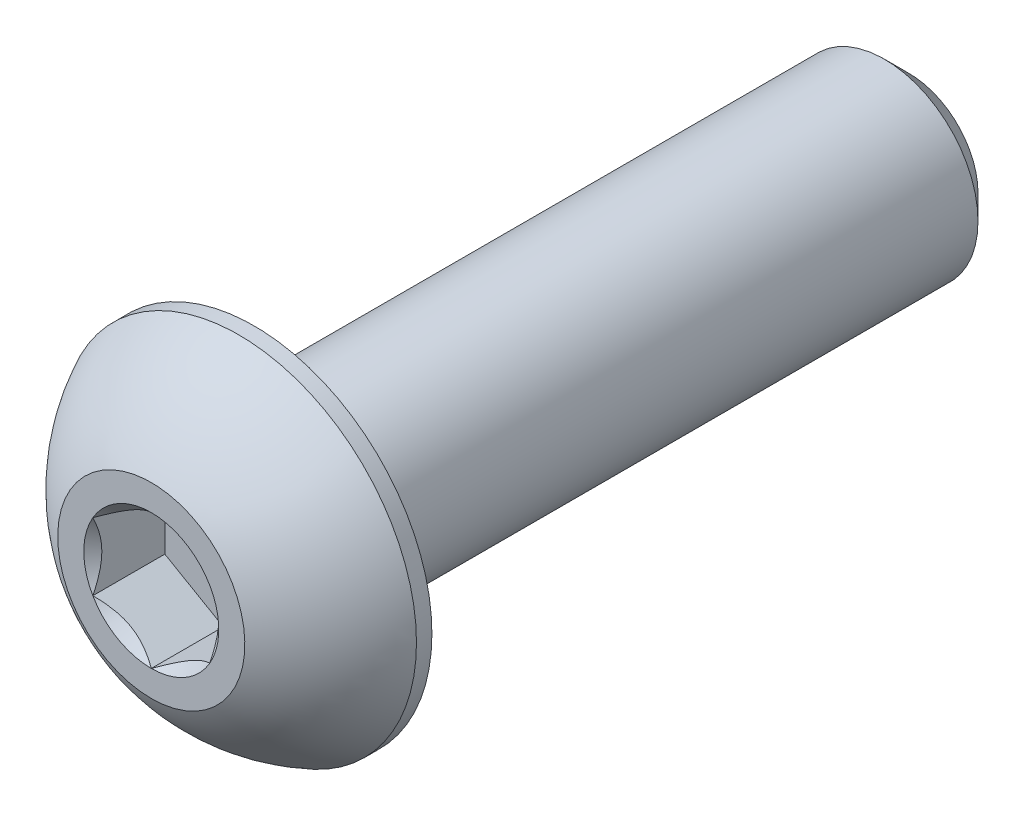
from build123d import *

# Parameters (mm, degrees)
CUT_EXTRUDE2_DEPTH = 1.54


with BuildPart() as part:
    # Sketch10 → Revolve3 (revolve)
    with BuildSketch(Plane(origin=(0, 0, 0), x_dir=(0, 0, -1), z_dir=(1, 0, 0))):
        Polygon((15.675, 2), (16.2, 1.475), (16.2, 0), (2.2, 0), (2.2, 2), align=None)
    revolve(axis=Axis((0, 0, 0), (0, 0, -1)))

    # Sketch7 → Revolve2 (revolve)
    with BuildSketch(Plane(origin=(0, 0, 0), x_dir=(0, 0, -1), z_dir=(1, 0, 0))):
        with BuildLine():
            Line((1.87, 3.8), (2.2, 3.8))
            Line((2.2, 3.8), (2.2, 0))
            Line((2.2, 0), (0, 0))
            Line((0, 0), (0, 2))
            ThreePointArc((0, 2), (0.793500147, 3.047002626), (1.87, 3.8))
        make_face()
    revolve(axis=Axis((0, 0, 0), (0, 0, -1)))

    # Sketch5 → Cut-Extrude2 (cut)
    with BuildSketch(Plane.XY):
        Polygon((1.25, -0.721687836), (1.25, 0.721687836), (0, 1.443375673), (-1.25, 0.721687836), (-1.25, -0.721687836), (0, -1.443375673), align=None)
    extrude(amount=-CUT_EXTRUDE2_DEPTH, mode=Mode.SUBTRACT)

    # Cut-Extrude3 cone 1 section (through the dimple's axis) → Cut-Extrude3 (revolve, cut)
    with BuildSketch(Plane(origin=(0, 0, 0), x_dir=(0, -1, 0), z_dir=(1, 0, 0))):
        Polygon((0, 0), (1.443375673, 0), (0, 1.443375673), align=None)
    revolve(axis=Axis((0, 0, 0), (0, 0, -1)), mode=Mode.SUBTRACT)


solid = part.part
